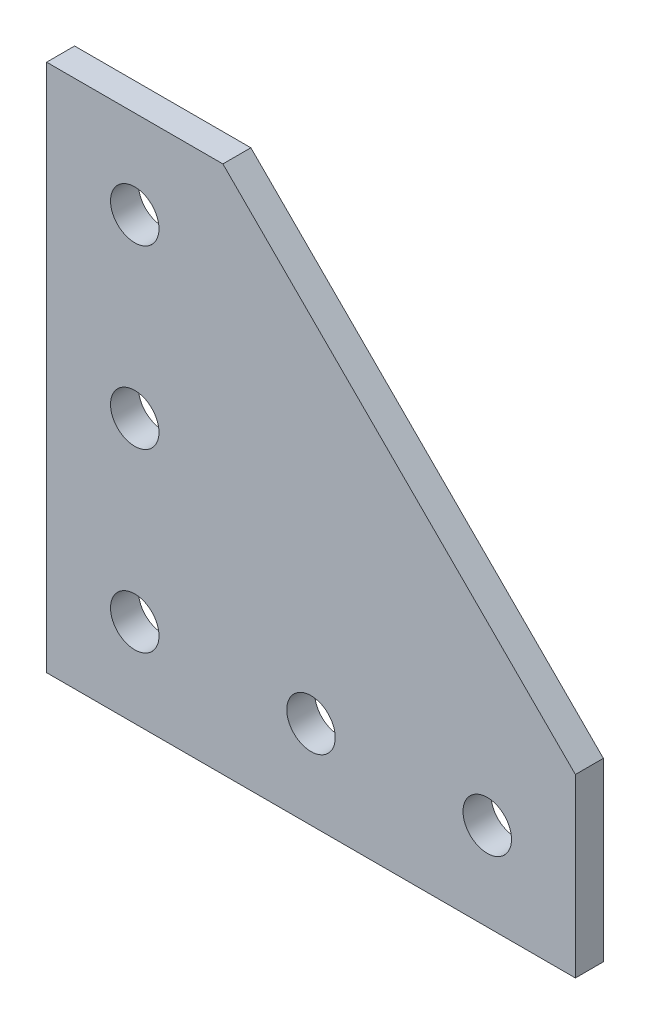
from build123d import *

# Parameters (mm, degrees)
BOSS_EXTRUDE1_DEPTH  = 3.175
M5_CLEARANCE_HOLE1_D = 5.5
LPATTERN1_COUNT      = 3
LPATTERN1_PITCH      = 20
LPATTERN2_COUNT      = 3
LPATTERN2_PITCH      = 20


with BuildPart() as part:
    # Sketch1 → Boss-Extrude1 (new body)
    with BuildSketch(Plane.XY):
        Polygon((0, 0), (0, 60), (20, 60), (60, 20), (60, 0), align=None)
    extrude(amount=BOSS_EXTRUDE1_DEPTH)

    # M5 Clearance Hole1 (through all)
    with Locations(Plane(origin=(10, 10, 3.175), x_dir=(1, 0, 0), z_dir=(0, 0, 1))):
        with Locations((0, 0)):
            m5_clearance_hole1 = Hole(M5_CLEARANCE_HOLE1_D / 2)

    # LPattern1: M5 Clearance Hole1 ×3
    with Locations(*[(i * LPATTERN1_PITCH, 0, 0) for i in range(1, LPATTERN1_COUNT)]):
        add(m5_clearance_hole1, mode=Mode.SUBTRACT)

    # LPattern2: M5 Clearance Hole1 ×3
    with Locations(*[(0, i * LPATTERN2_PITCH, 0) for i in range(1, LPATTERN2_COUNT)]):
        add(m5_clearance_hole1, mode=Mode.SUBTRACT)


solid = part.part
